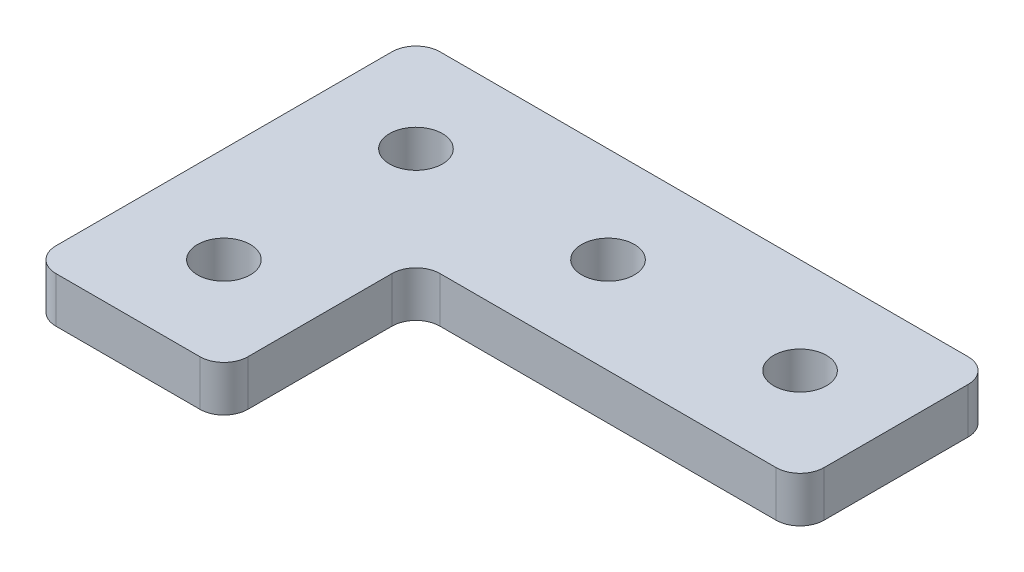
from build123d import *

# Parameters (mm, degrees)
SKETCH1_R           = 2.75
BOSS_EXTRUDE1_DEPTH = 2.3749


with BuildPart() as part:
    # Sketch1 → Boss-Extrude1 (new, symmetric)
    with BuildSketch(Plane(origin=(0, 0, 0), x_dir=(1, 0, 0), z_dir=(0, 1, 0))):
        with BuildLine():
            Line((-10, 7.5), (-10, -27.5))
            ThreePointArc((-10, -27.5), (-9.267766953, -29.267766953), (-7.5, -30))
            Line((-7.5, -30), (7.5, -30))
            ThreePointArc((7.5, -30), (9.267766953, -29.267766953), (10, -27.5))
            Line((10, -27.5), (10, -12.5))
            ThreePointArc((10, -12.5), (10.732233047, -10.732233047), (12.5, -10))
            Line((12.5, -10), (47.5, -10))
            ThreePointArc((47.5, -10), (49.267766953, -9.267766953), (50, -7.5))
            Line((50, -7.5), (50, 7.5))
            ThreePointArc((50, 7.5), (49.267766953, 9.267766953), (47.5, 10))
            Line((47.5, 10), (-7.5, 10))
            ThreePointArc((-7.5, 10), (-9.267766953, 9.267766953), (-10, 7.5))
        make_face()
        with Locations(Location((0, 0, 0), (0, 0, 270))):
            Circle(SKETCH1_R, mode=Mode.SUBTRACT)
        with Locations(Location((20, 0, 0), (0, 0, 270))):
            Circle(SKETCH1_R, mode=Mode.SUBTRACT)
        with Locations(Location((40, 0, 0), (0, 0, 270))):
            Circle(SKETCH1_R, mode=Mode.SUBTRACT)
        with Locations(Location((0, -20, 0), (0, 0, 270))):
            Circle(SKETCH1_R, mode=Mode.SUBTRACT)
    extrude(amount=BOSS_EXTRUDE1_DEPTH, both=True)


solid = part.part
